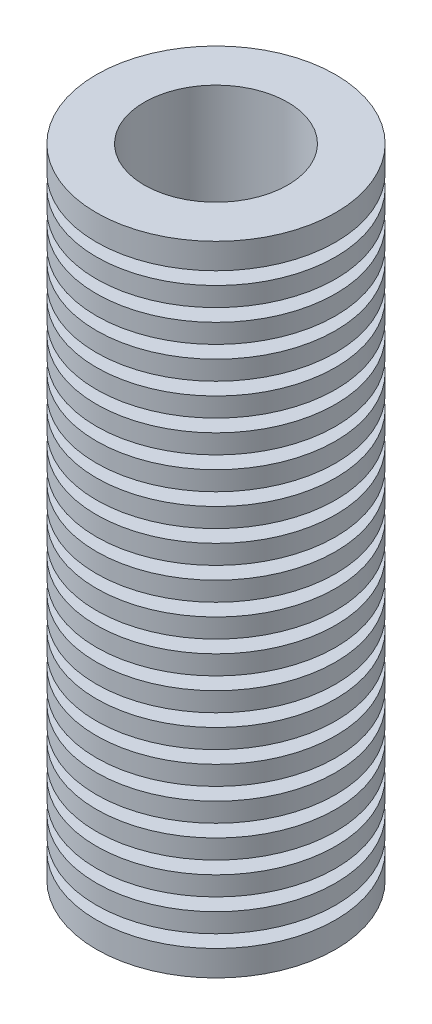
from build123d import *

# Parameters (mm, degrees)
SKETCH1_R               = 37.5
BOSS_EXTRUDE1_DEPTH     = 100
CUT_EXTRUDE1_DEPTH      = 114.192314227
CUT_EXTRUDE1_DEPTH_BACK = 114.192314227
SKETCH2_R               = 22.5
SKETCH3_W               = 11
SKETCH3_H               = 4
LPATTERN1_COUNT         = 19
LPATTERN1_PITCH         = 10


with BuildPart() as part:
    # Sketch1 → Boss-Extrude1 (new, symmetric)
    with BuildSketch(Plane(origin=(0, 0, 0), x_dir=(1, 0, 0), z_dir=(0, 1, 0))):
        with Locations(Location((0, 0, 0), (0, 0, 270))):
            Circle(SKETCH1_R)
    extrude(amount=BOSS_EXTRUDE1_DEPTH, both=True)

    # Sketch2 → Cut-Extrude1 (cut, two sides: drawn at the far end of the back side and taken through both)
    with BuildSketch(Plane(origin=(0, 0, 0), x_dir=(1, 0, 0), z_dir=(0, 1, 0)).offset(-CUT_EXTRUDE1_DEPTH_BACK)):
        with Locations(Location((0, 0, 0), (0, 0, 270))):
            Circle(SKETCH2_R)
    extrude(amount=CUT_EXTRUDE1_DEPTH + CUT_EXTRUDE1_DEPTH_BACK, mode=Mode.SUBTRACT)

    # Sketch3 → Cut-Revolve1 (revolve, cut)
    with BuildSketch(Plane.XY, mode=Mode.PRIVATE) as cut_revolve1_sk:
        with Locations((32, 90)):
            Rectangle(SKETCH3_W, SKETCH3_H)
    cut_revolve1 = revolve(cut_revolve1_sk.sketch.rotate(Axis((0, -110, 0), (0, 1, 0)), 90), axis=Axis((0, -110, 0), (0, 1, 0)), mode=Mode.SUBTRACT)

    # LPattern1: Cut-Revolve1 ×19
    with Locations(*[(0, -i * LPATTERN1_PITCH, 0) for i in range(1, LPATTERN1_COUNT)]):
        add(cut_revolve1, mode=Mode.SUBTRACT)


solid = part.part
